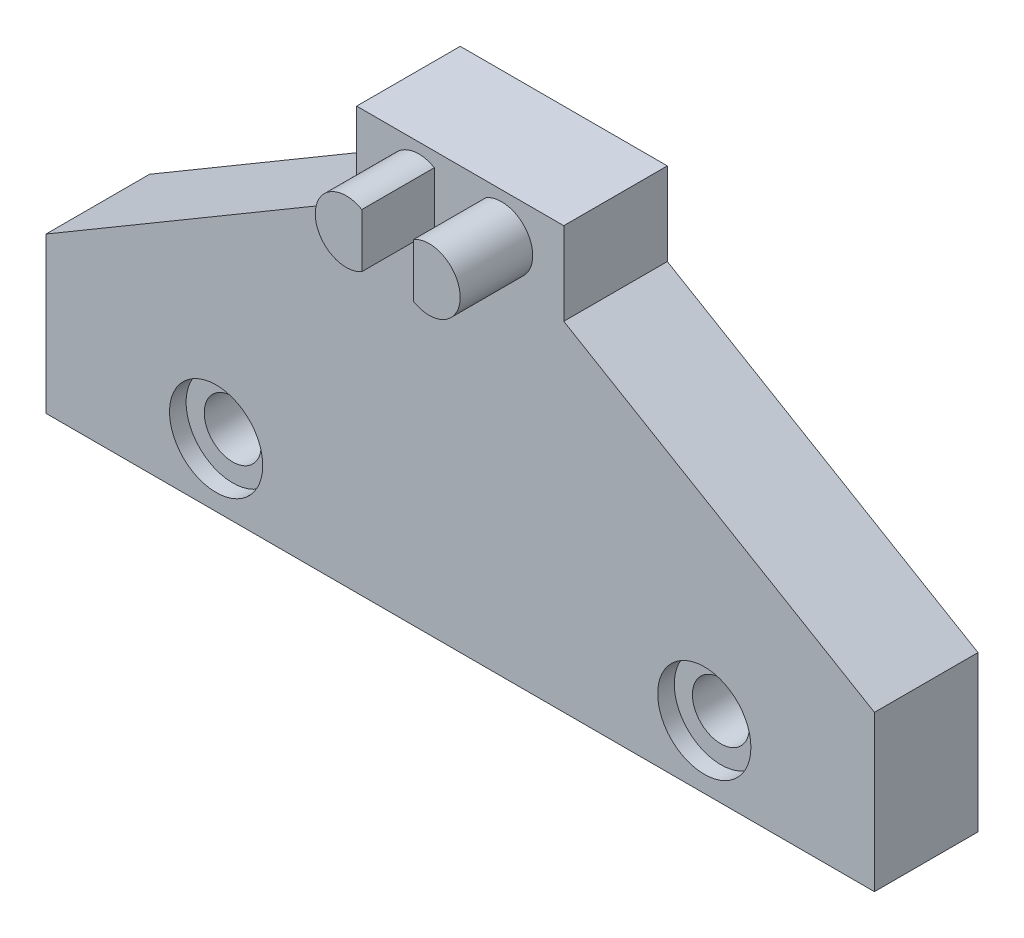
from build123d import *

# Parameters (mm, degrees)
BOSS_EXTRUDE1_DEPTH = 10
SKETCH3_R           = 3
BOSS_EXTRUDE2_DEPTH = 7
SKETCH4_R           = 2.75
CUT_EXTRUDE1_DEPTH  = 64.215786076
SKETCH5_W           = 5
SKETCH5_H           = 40.7
CUT_EXTRUDE2_DEPTH  = 7
SKETCH6_R           = 4.5
CUT_EXTRUDE3_DEPTH  = 1.6


with BuildPart() as part:
    # Sketch2 → Boss-Extrude1 (new body)
    with BuildSketch(Plane.XY):
        Polygon((-24.382192178, 22.640051942), (-54.382192178, 4.940051942), (-54.382192178, -10.059948058), (25.617807822, -10.059948058), (25.617807822, 4.940051942), (-4.382192178, 22.640051942), (-4.382192178, 30.640051942), (-24.382192178, 30.640051942), align=None)
    extrude(amount=BOSS_EXTRUDE1_DEPTH)

    # Sketch3 → Boss-Extrude2 (add)
    with BuildSketch(Plane.XY.offset(10)):
        with Locations((-18.382192178, 26.640051942)):
            Circle(SKETCH3_R)
    boss_extrude2 = extrude(amount=BOSS_EXTRUDE2_DEPTH)

    # Mirror1: Boss-Extrude2 across plane
    add(boss_extrude2.mirror(Plane.ZY.offset(14.382192178)))

    # Sketch4 → Cut-Extrude1 (cut, through all)
    with BuildSketch(Plane.XY.offset(10)):
        with Locations((-37.952192178, -3.959948058)):
            Circle(SKETCH4_R)
    cut_extrude1 = extrude(amount=-CUT_EXTRUDE1_DEPTH, mode=Mode.SUBTRACT)

    # Mirror2: Cut-Extrude1 across plane
    add(cut_extrude1.mirror(Plane.ZY.offset(14.382192178)), mode=Mode.SUBTRACT)

    # Sketch5 → Cut-Extrude2 (cut)
    with BuildSketch(Plane.XY.offset(10)):
        with Locations((-14.382192178, 10.290051942)):
            Rectangle(SKETCH5_W, SKETCH5_H)
    extrude(amount=CUT_EXTRUDE2_DEPTH, mode=Mode.SUBTRACT)

    # Sketch6 → Cut-Extrude3 (cut)
    with BuildSketch(Plane.XY.offset(10)):
        with Locations((-37.952192178, -3.959948058)):
            Circle(SKETCH6_R)
        with Locations((9.187807822, -3.959948058)):
            Circle(SKETCH6_R)
    extrude(amount=-CUT_EXTRUDE3_DEPTH, mode=Mode.SUBTRACT)


solid = part.part
